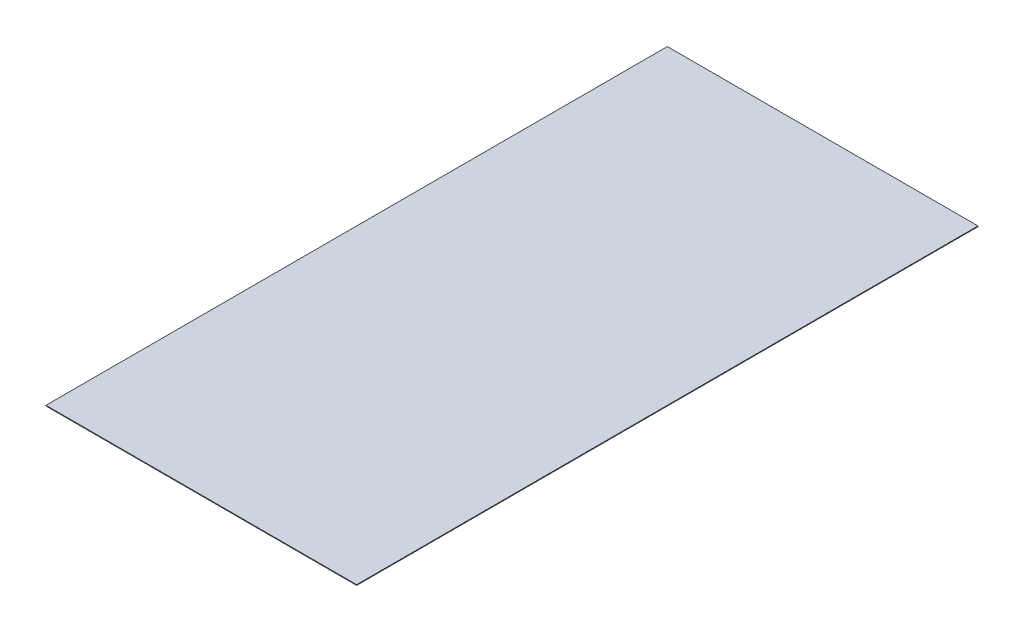
from build123d import *

# Parameters (mm, degrees)
CROQUIS1_W              = 1219.2
CROQUIS1_H              = 2438.4
SALIENTE_EXTRUIR1_DEPTH = 2.7


with BuildPart() as part:
    # Croquis1 → Saliente-Extruir1 (new body)
    with BuildSketch(Plane(origin=(0, 0, 0), x_dir=(1, 0, 0), z_dir=(0, 1, 0))):
        Rectangle(CROQUIS1_W, CROQUIS1_H)
    extrude(amount=SALIENTE_EXTRUIR1_DEPTH)


solid = part.part
